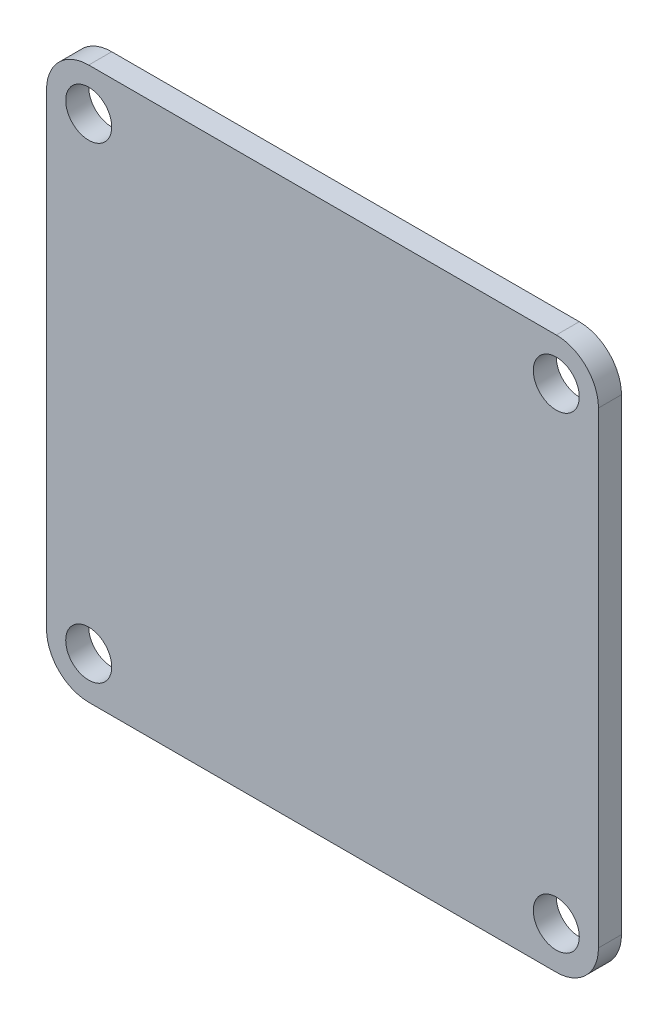
from build123d import *

# Parameters (mm, degrees)
SKETCH_1_R      = 1.5
EXTRUDE_1_DEPTH = 1.5


with BuildPart() as part:
    # 草图1 → 凸台-拉伸1 (new body)
    with BuildSketch(Plane.XY):
        with BuildLine():
            Line((-15.25, 18), (15.25, 18))
            ThreePointArc((15.25, 18), (17.194543648, 17.194543648), (18, 15.25))
            Line((18, 15.25), (18, -15.25))
            ThreePointArc((18, -15.25), (17.194543648, -17.194543648), (15.25, -18))
            Line((15.25, -18), (-15.25, -18))
            ThreePointArc((-15.25, -18), (-17.194543648, -17.194543648), (-18, -15.25))
            Line((-18, -15.25), (-18, 15.25))
            ThreePointArc((-18, 15.25), (-17.194543648, 17.194543648), (-15.25, 18))
        make_face()
        with Locations((-15.25, 15.25)):
            Circle(SKETCH_1_R, mode=Mode.SUBTRACT)
        with Locations(Location((15.25, 15.25, 0), (0, 0, 180))):
            Circle(SKETCH_1_R, mode=Mode.SUBTRACT)
        with Locations((15.25, -15.25)):
            Circle(SKETCH_1_R, mode=Mode.SUBTRACT)
        with Locations(Location((-15.25, -15.25, 0), (0, 0, 180))):
            Circle(SKETCH_1_R, mode=Mode.SUBTRACT)
    extrude(amount=EXTRUDE_1_DEPTH)


solid = part.part
